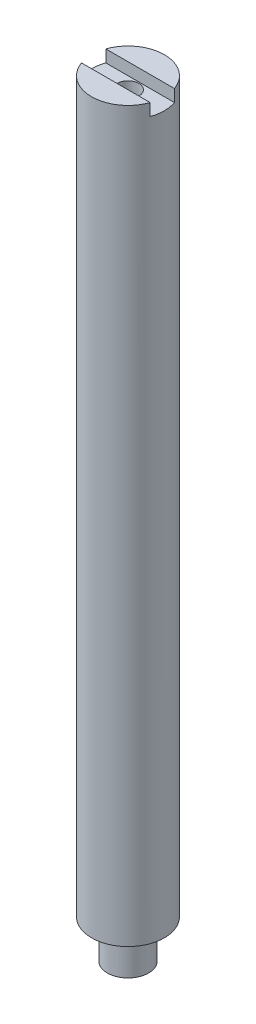
from build123d import *

# Parameters (mm, degrees)
SKETCH1_R           = 4.25
BOSS_EXTRUDE1_DEPTH = 7.9
SKETCH2_R           = 7.5
BOSS_EXTRUDE2_DEPTH = 150
SKETCH3_R           = 2.25
CUT_EXTRUDE1_DEPTH  = 159.255837175
SKETCH4_W           = 15
SKETCH4_H           = 5
CUT_EXTRUDE2_DEPTH  = 2.5


with BuildPart() as part:
    # Sketch1 → Boss-Extrude1 (new body)
    with BuildSketch(Plane(origin=(0, 0, 0), x_dir=(1, 0, 0), z_dir=(0, 1, 0))):
        with Locations(Location((0, 0, 0), (0, 0, 270))):
            Circle(SKETCH1_R)
    extrude(amount=BOSS_EXTRUDE1_DEPTH)

    # Sketch2 → Boss-Extrude2 (add)
    with BuildSketch(Plane(origin=(0, 7.9, 0), x_dir=(1, 0, 0), z_dir=(0, 1, 0))):
        with Locations(Location((0, 0, 0), (0, 0, 270))):
            Circle(SKETCH2_R)
    extrude(amount=BOSS_EXTRUDE2_DEPTH)

    # Sketch3 → Cut-Extrude1 (cut, through all)
    with BuildSketch(Plane(origin=(0, 157.9, 0), x_dir=(1, 0, 0), z_dir=(0, 1, 0))):
        with Locations(Location((0, 0, 0), (0, 0, 270))):
            Circle(SKETCH3_R)
    extrude(amount=-CUT_EXTRUDE1_DEPTH, mode=Mode.SUBTRACT)

    # Sketch4 → Cut-Extrude2 (cut)
    with BuildSketch(Plane(origin=(0, 157.9, 0), x_dir=(1, 0, 0), z_dir=(0, 1, 0))):
        Rectangle(SKETCH4_W, SKETCH4_H)
    extrude(amount=-CUT_EXTRUDE2_DEPTH, mode=Mode.SUBTRACT)


solid = part.part
